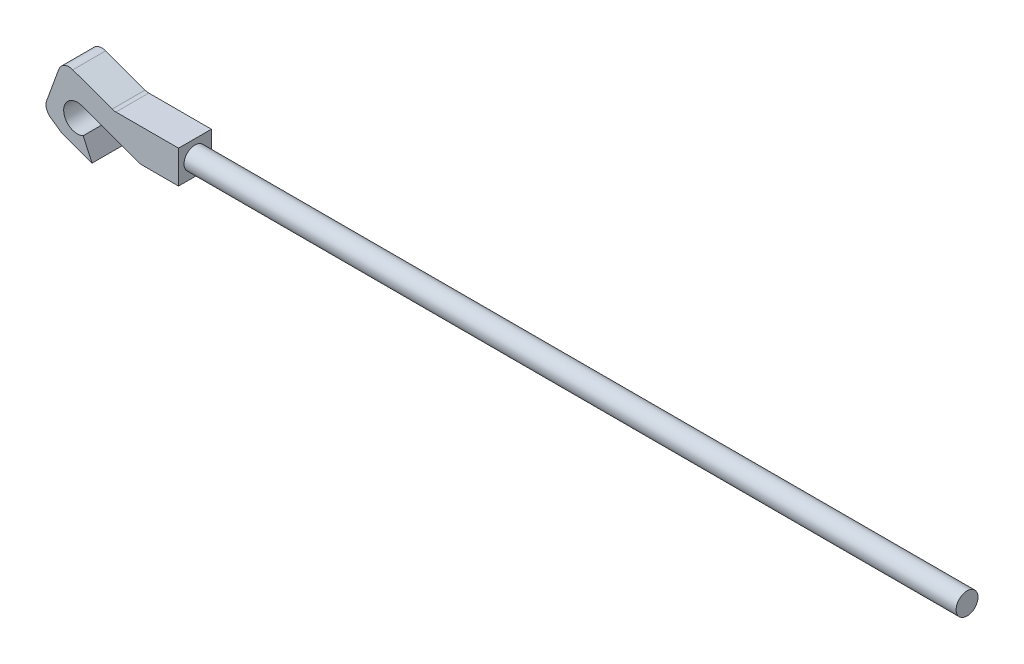
from build123d import *

# Parameters (mm, degrees)
SKETCH1_R           = 25.4
BOSS_EXTRUDE1_DEPTH = 1828.8
BOSS_EXTRUDE2_DEPTH = 38.1
SCALE1_SCALE        = 2


with BuildPart() as part:
    # Sketch1 → Boss-Extrude1 (new body)
    with BuildSketch(Plane(origin=(0, 0, 0), x_dir=(0, 0, -1), z_dir=(1, 0, 0))):
        with Locations(Location((0, 0, 0), (0, 0, 180))):
            Circle(SKETCH1_R)
    extrude(amount=BOSS_EXTRUDE1_DEPTH)

    # Sketch2 → Boss-Extrude2 (add, symmetric)
    with BuildSketch(Plane.XY):
        with BuildLine():
            Line((38.1, -38.1), (-46.32129469, -38.1))
            ThreePointArc((-46.32129469, -38.1), (-50.731958403, -37.714116927), (-55.00860633, -36.568192568))
            Line((-55.00860633, -36.568192568), (-185.690096464, 10.99598001))
            ThreePointArc((-185.690096464, 10.99598001), (-228.26901705, -20.224176249), (-183.131106204, -47.614532938))
            Line((-183.131106204, -47.614532938), (-162.342385793, -92.196087728))
            Line((-162.342385793, -92.196087728), (-233.946963497, -66.134152806))
            Line((-233.946963497, -66.134152806), (-258.440677117, -48.983469891))
            ThreePointArc((-258.440677117, -48.983469891), (-268.096246183, -35.814935274), (-267.740028202, -19.489696326))
            Line((-267.740028202, -19.489696326), (-239.656790314, 57.668365634))
            ThreePointArc((-239.656790314, 57.668365634), (-226.523101595, 72.001271785), (-207.101286106, 72.849246562))
            Line((-207.101286106, 72.849246562), (-115.837122165, 39.631807432))
            ThreePointArc((-115.837122165, 39.631807432), (-111.560474237, 38.485883073), (-107.149810524, 38.1))
            Line((-107.149810524, 38.1), (38.1, 38.1))
            Line((38.1, 38.1), (38.1, -38.1))
        make_face()
    extrude(amount=BOSS_EXTRUDE2_DEPTH, both=True)


with BuildPart() as part_1:
    # Scale1: scaled about (593.130591899, 1.21334117, 0)
    add(part.part.scale(SCALE1_SCALE).moved(Location((-593.130591899, -1.21334117, 0))))


solid = part_1.part
